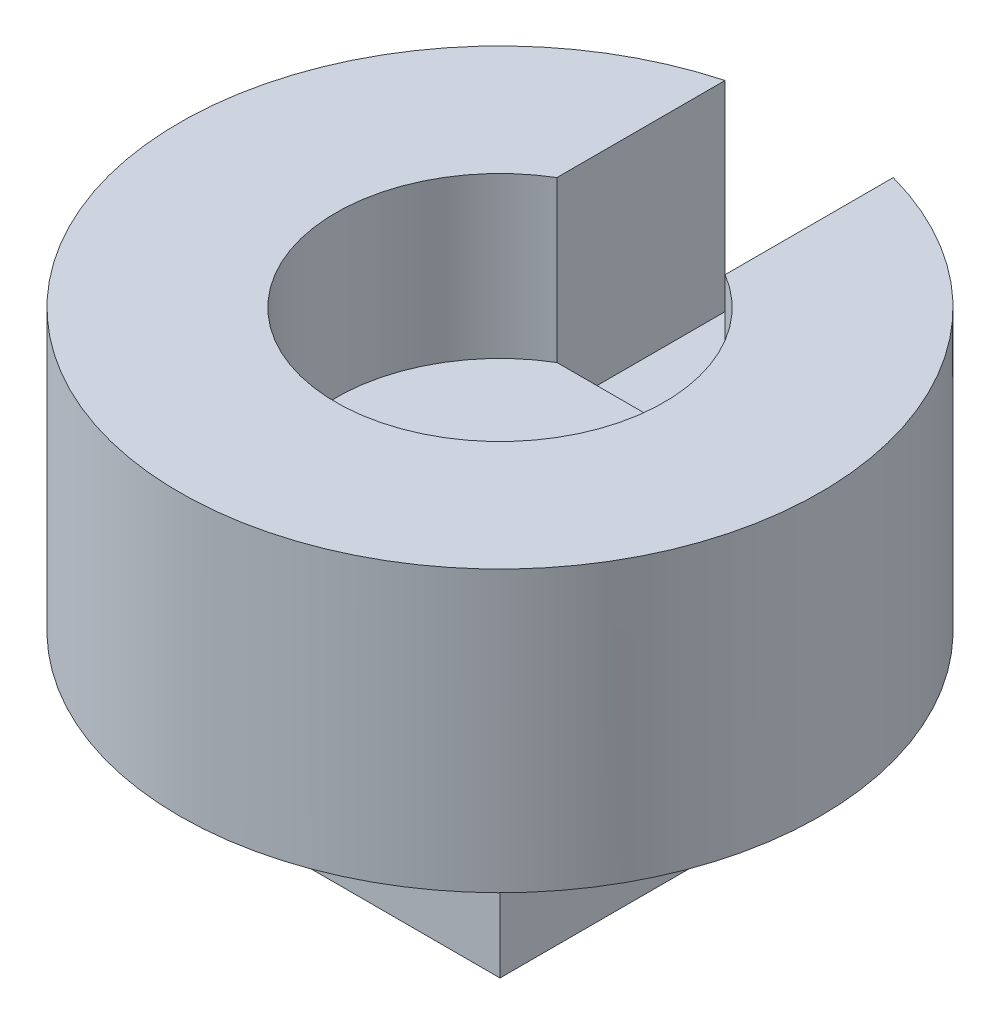
from build123d import *

# Parameters (mm, degrees)
SKETCH1_W           = 2.5
SKETCH1_H           = 2.5
BOSS_EXTRUDE1_DEPTH = 2.5
SKETCH2_R           = 4
BOSS_EXTRUDE2_DEPTH = 3.5
CUT_EXTRUDE1_DEPTH  = 2
CUT_EXTRUDE2_DEPTH  = 0.5


with BuildPart() as part:
    # Sketch1 → Boss-Extrude1 (new body)
    with BuildSketch(Plane(origin=(0, 0, 0), x_dir=(1, 0, 0), z_dir=(0, 1, 0))):
        Rectangle(SKETCH1_W, SKETCH1_H)
    extrude(amount=BOSS_EXTRUDE1_DEPTH)

    # Sketch2 → Boss-Extrude2 (add)
    with BuildSketch(Plane(origin=(0, 2.5, 0), x_dir=(1, 0, 0), z_dir=(0, 1, 0))):
        with Locations(Location((0, 0, 0), (0, 0, 270))):
            Circle(SKETCH2_R)
    extrude(amount=BOSS_EXTRUDE2_DEPTH)

    # Sketch3 → Cut-Extrude1 (cut)
    with BuildSketch(Plane(origin=(0, 6, 0), x_dir=(1, 0, 0), z_dir=(0, 1, 0))):
        with BuildLine():
            Line((1.05, 1.760681686), (1.05, 4))
            Line((1.05, 4), (-1.05, 4))
            Line((-1.05, 4), (-1.05, 1.760681686))
            ThreePointArc((-1.05, 1.760681686), (0, -2.05), (1.05, 1.760681686))
        make_face()
    extrude(amount=-CUT_EXTRUDE1_DEPTH, mode=Mode.SUBTRACT)

    # Sketch5 → Cut-Extrude2 (cut)
    with BuildSketch(Plane(origin=(0, 4, 0), x_dir=(1, 0, 0), z_dir=(0, 1, 0))):
        with BuildLine():
            ThreePointArc((1.05, 1.760681686), (0, 2.05), (-1.05, 1.760681686))
            Line((-1.05, 1.760681686), (1.05, 1.760681686))
        make_face()
        with BuildLine():
            Line((-1.05, 3.85972797), (-1.05, 1.760681686))
            ThreePointArc((-1.05, 1.760681686), (0, 2.05), (1.05, 1.760681686))
            Line((1.05, 1.760681686), (1.05, 3.85972797))
            ThreePointArc((1.05, 3.85972797), (0.5296641, 3.964776909), (-2e-09, 4))
            ThreePointArc((-2e-09, 4), (-0.529664103, 3.964776909), (-1.05, 3.85972797))
        make_face()
    extrude(amount=-CUT_EXTRUDE2_DEPTH, mode=Mode.SUBTRACT)


solid = part.part
